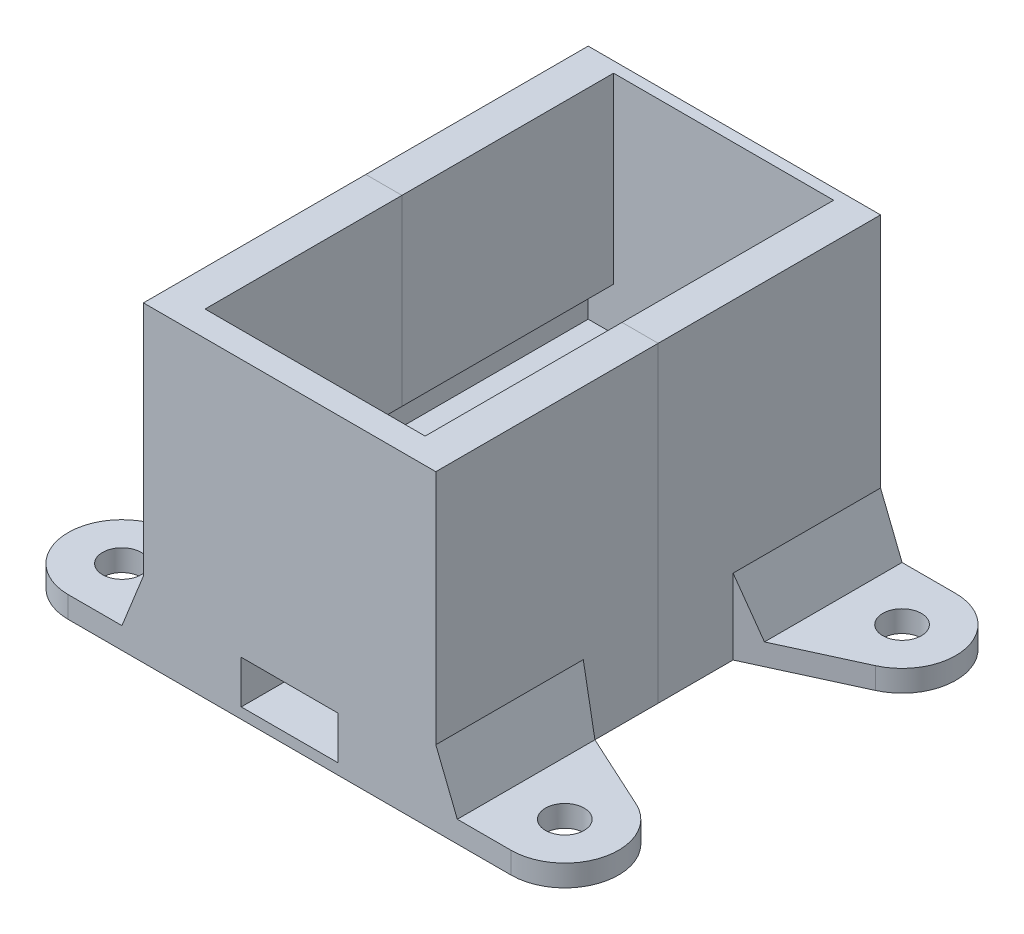
from build123d import *

# Parameters (mm, degrees)
SKETCH3_W            = 34.54
SKETCH3_H            = 52.54
SKETCH3_W_2          = 22.479
SKETCH3_H_2          = 38.1
BOSS_EXTRUDE1_DEPTH  = 10.16
SKETCH4_W            = 34.54
SKETCH4_H            = 52.54
SKETCH4_W_2          = 32
SKETCH4_H_2          = 50
BOSS_EXTRUDE2_DEPTH  = 5.08
SKETCH6_W            = 34.54
SKETCH6_H            = 52.54
SKETCH6_W_2          = 26
SKETCH6_H_2          = 48.26
BOSS_EXTRUDE3_DEPTH  = 21.59
CUT_EXTRUDE1_REACH   = 68.447
SKETCH8_W            = 11.43
SKETCH8_H            = 5.08
BOSS_EXTRUDE5_DEPTH  = 2.54
SKETCH13_R           = 2.286
CUT_EXTRUDE6_DEPTH   = 2.54
BOSS_EXTRUDE6_DEPTH  = 17.421603206
CUT_EXTRUDE7_DEPTH   = 55.177663525
MIRROR5_COPY_1_DEPTH = 17.421603206
MIRROR5_COPY_2_DEPTH = 55.177663525


with BuildPart() as part:
    # Sketch3 → Boss-Extrude1 (new body)
    with BuildSketch(Plane(origin=(0, 0, 0), x_dir=(1, 0, 0), z_dir=(0, 1, 0))):
        with Locations((0, -0.235)):
            Rectangle(SKETCH3_W, SKETCH3_H)
        Rectangle(SKETCH3_W_2, SKETCH3_H_2, mode=Mode.SUBTRACT)
    extrude(amount=BOSS_EXTRUDE1_DEPTH)

    # Sketch4 → Boss-Extrude2 (add)
    with BuildSketch(Plane(origin=(0, 10.16, 0), x_dir=(1, 0, 0), z_dir=(0, 1, 0))):
        with Locations((0, -0.235)):
            Rectangle(SKETCH4_W, SKETCH4_H)
        with Locations((0, -0.235)):
            Rectangle(SKETCH4_W_2, SKETCH4_H_2, mode=Mode.SUBTRACT)
    extrude(amount=BOSS_EXTRUDE2_DEPTH)

    # Sketch6 → Boss-Extrude3 (add)
    with BuildSketch(Plane(origin=(0, 15.24, 0), x_dir=(1, 0, 0), z_dir=(0, 1, 0))):
        with Locations((0, -0.235)):
            Rectangle(SKETCH6_W, SKETCH6_H)
        with Locations((0, 0.635)):
            Rectangle(SKETCH6_W_2, SKETCH6_H_2, mode=Mode.SUBTRACT)
    extrude(amount=BOSS_EXTRUDE3_DEPTH)

    # Cut-Extrude1: up to this face of the body (flat: up to its plane)
    cut_extrude1_end = Plane(part.part.faces().sort_by_distance((0, 18.415, -26.035))[0])
    # Sketch8 → Cut-Extrude1 (cut, up to the picked face)
    with BuildSketch(Plane.XY.offset(26.505), mode=Mode.PRIVATE) as cut_extrude1_sk1:
        with Locations((0, 3.81)):
            Rectangle(SKETCH8_W, SKETCH8_H)
    cut_extrude1_tool1 = split(extrude(cut_extrude1_sk1.sketch, amount=-CUT_EXTRUDE1_REACH, mode=Mode.PRIVATE), bisect_by=cut_extrude1_end, keep=Keep.BOTH, mode=Mode.PRIVATE)
    add(cut_extrude1_tool1.solids().sort_by(Axis((0, 3.81, 26.505), (0, 0, -1)))[0], mode=Mode.SUBTRACT)

    # Sketch12 → Boss-Extrude5 (add)
    with BuildSketch(Plane(origin=(0, 0, 0), x_dir=(1, 0, 0), z_dir=(0, 1, 0))):
        with BuildLine():
            Line((17.27, 8.613396683), (28.810641327, 13.914679337))
            ThreePointArc((28.810641327, 13.914679337), (32.363387631, 21.041643613), (26.16, 26.035))
            Line((26.16, 26.035), (17.27, 26.035))
            Line((17.27, 26.035), (17.27, 8.613396683))
        make_face()
        with BuildLine():
            Line((17.27, -26.505), (26.16, -26.505))
            ThreePointArc((26.16, -26.505), (32.363387631, -21.511643613), (28.810641327, -14.384679337))
            Line((28.810641327, -14.384679337), (17.27, -9.083396683))
            Line((17.27, -9.083396683), (17.27, -26.505))
        make_face()
        with BuildLine():
            Line((-17.27, -9.083396683), (-28.810641327, -14.384679337))
            ThreePointArc((-28.810641327, -14.384679337), (-32.363387631, -21.511643613), (-26.16, -26.505))
            Line((-26.16, -26.505), (-17.27, -26.505))
            Line((-17.27, -26.505), (-17.27, -9.083396683))
        make_face()
        with BuildLine():
            Line((-28.810641327, 13.914679337), (-17.27, 8.613396683))
            Line((-17.27, 8.613396683), (-17.27, 26.035))
            Line((-17.27, 26.035), (-26.16, 26.035))
            ThreePointArc((-26.16, 26.035), (-32.363387631, 21.041643613), (-28.810641327, 13.914679337))
        make_face()
    extrude(amount=BOSS_EXTRUDE5_DEPTH)

    # Sketch13 → Cut-Extrude6 (cut)
    with BuildSketch(Plane(origin=(0, 2.54, 0), x_dir=(1, 0, 0), z_dir=(0, 1, 0))):
        with Locations(Location((26.16, 19.685, 0), (0, 0, 270))):
            Circle(SKETCH13_R)
        with Locations(Location((26.16, -20.155, 0), (0, 0, 270))):
            Circle(SKETCH13_R)
        with Locations(Location((-26.16, -20.155, 0), (0, 0, 270))):
            Circle(SKETCH13_R)
        with Locations(Location((-26.16, 19.685, 0), (0, 0, 270))):
            Circle(SKETCH13_R)
    extrude(amount=-CUT_EXTRUDE6_DEPTH, mode=Mode.SUBTRACT)

    # Sketch14 → Boss-Extrude6 (add)
    with BuildSketch(Plane.XY.offset(26.505)):
        Polygon((17.27, 8.89), (19.81, 2.54), (17.27, 2.54), align=None)
    boss_extrude6 = extrude(amount=-BOSS_EXTRUDE6_DEPTH)

    # Sketch15 → Cut-Extrude7 (cut, through all)
    with BuildSketch(Plane.XZ.offset(-2.54)):
        Polygon((17.27, 9.083396794), (19.81, 10.250165285), (19.81, 9.083396794), align=None)
    cut_extrude7 = extrude(amount=-CUT_EXTRUDE7_DEPTH, mode=Mode.SUBTRACT)

    # Mirror4: Boss-Extrude6, Cut-Extrude7 across plane
    add(boss_extrude6.mirror(Plane(origin=(0, 0, 0), x_dir=(0, 0, 1), z_dir=(1, 0, 0))))
    add(cut_extrude7.mirror(Plane(origin=(0, 0, 0), x_dir=(0, 0, 1), z_dir=(1, 0, 0))), mode=Mode.SUBTRACT)

    # Mirror5: Boss-Extrude6, Cut-Extrude7 across plane
    add(boss_extrude6.mirror(Plane.XY.offset(0.235)))
    add(cut_extrude7.mirror(Plane.XY.offset(0.235)), mode=Mode.SUBTRACT)

    # Mirror5 copy 1 sketch → Mirror5 copy 1 (add)
    with BuildSketch(Plane(origin=(0, 0, -26.035), x_dir=(-1, 0, 0), z_dir=(0, 0, -1))):
        Polygon((17.27, 8.89), (19.81, 2.54), (17.27, 2.54), align=None)
    extrude(amount=-MIRROR5_COPY_1_DEPTH)

    # Mirror5 copy 2 sketch → Mirror5 copy 2 (cut, through all)
    with BuildSketch(Plane(origin=(0, 2.54, 0.47), x_dir=(-1, 0, 0), z_dir=(0, -1, 0))):
        Polygon((17.27, 9.083396794), (19.81, 10.250165285), (19.81, 9.083396794), align=None)
    extrude(amount=-MIRROR5_COPY_2_DEPTH, mode=Mode.SUBTRACT)


with BuildPart() as body_2:
    # Split3: the piece on the far side of the plane
    add(part.part)
    split(bisect_by=Plane.XY.offset(0.235), keep=Keep.BOTTOM)


with BuildPart() as part_1:
    add(part.part)

    # Split3
    split(bisect_by=Plane.XY.offset(0.235), keep=Keep.TOP)


solid = Compound([body_2.part, part_1.part])
